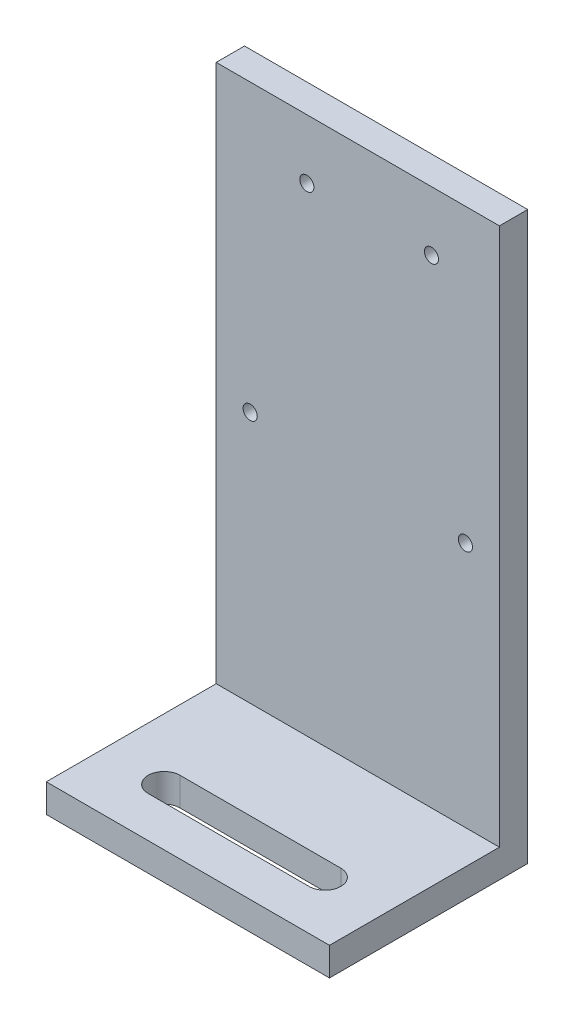
from build123d import *

# Parameters (mm, degrees)
SKETCH1_W           = 63.5
SKETCH1_H           = 127
BOSS_EXTRUDE1_DEPTH = 6.35
SKETCH2_R           = 1.5875
CUT_EXTRUDE1_DEPTH  = 143.132235964
SKETCH3_W           = 63.5
SKETCH3_H           = 6.35
BOSS_EXTRUDE2_DEPTH = 38.1
CUT_EXTRUDE2_DEPTH  = 144.403190341


with BuildPart() as part:
    # Sketch1 → Boss-Extrude1 (new body)
    with BuildSketch(Plane.XY):
        with Locations((31.75, 63.5)):
            Rectangle(SKETCH1_W, SKETCH1_H)
    extrude(amount=BOSS_EXTRUDE1_DEPTH)

    # Sketch2 → Cut-Extrude1 (cut, through all)
    with BuildSketch(Plane.XY.offset(6.35)):
        with Locations((55.88, 61.595)):
            Circle(SKETCH2_R)
        with Locations((7.62, 62.865)):
            Circle(SKETCH2_R)
        with Locations((20.32, 113.665)):
            Circle(SKETCH2_R)
        with Locations((48.26, 113.665)):
            Circle(SKETCH2_R)
    extrude(amount=-CUT_EXTRUDE1_DEPTH, mode=Mode.SUBTRACT)

    # Sketch3 → Boss-Extrude2 (add)
    with BuildSketch(Plane.XY.offset(6.35)):
        with Locations((31.75, 3.175)):
            Rectangle(SKETCH3_W, SKETCH3_H)
    extrude(amount=BOSS_EXTRUDE2_DEPTH)

    # Sketch4 → Cut-Extrude2 (cut, through all)
    with BuildSketch(Plane(origin=(0, 6.35, 0), x_dir=(1, 0, 0), z_dir=(0, 1, 0))):
        with BuildLine():
            Line((13.716, -28.194), (49.784, -28.194))
            ThreePointArc((49.784, -28.194), (53.34, -31.75), (49.784, -35.306))
            Line((49.784, -35.306), (13.716, -35.306))
            ThreePointArc((13.716, -35.306), (10.16, -31.75), (13.716, -28.194))
        make_face()
    extrude(amount=-CUT_EXTRUDE2_DEPTH, mode=Mode.SUBTRACT)


solid = part.part
